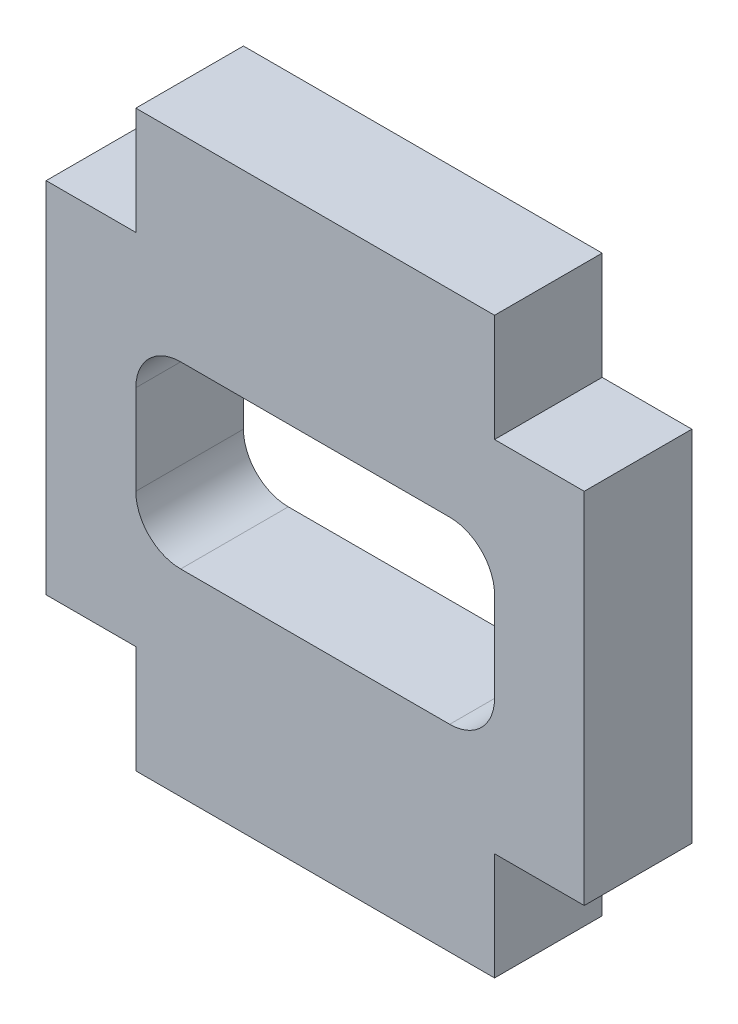
from build123d import *

# Parameters (mm, degrees)
SALIENTE_EXTRUIR1_DEPTH = 3


with BuildPart() as part:
    # Croquis1 → Saliente-Extruir1 (new body)
    with BuildSketch(Plane.XY):
        Polygon((-5, -8), (5, -8), (5, -5), (7.5, -5), (7.5, 5), (5, 5), (5, 8), (-5, 8), (-5, 5), (-7.5, 5), (-7.5, -5), (-5, -5), align=None)
        with BuildLine():
            ThreePointArc((5, -1.25), (4.633883476, -2.133883476), (3.75, -2.5))
            Line((3.75, -2.5), (-3.75, -2.5))
            ThreePointArc((-3.75, -2.5), (-4.633883476, -2.133883476), (-5, -1.25))
            Line((-5, -1.25), (-5, 1.25))
            ThreePointArc((-5, 1.25), (-4.633883476, 2.133883476), (-3.75, 2.5))
            Line((-3.75, 2.5), (3.75, 2.5))
            ThreePointArc((3.75, 2.5), (4.633883476, 2.133883476), (5, 1.25))
            Line((5, 1.25), (5, -1.25))
        make_face(mode=Mode.SUBTRACT)
    extrude(amount=SALIENTE_EXTRUIR1_DEPTH)


solid = part.part
